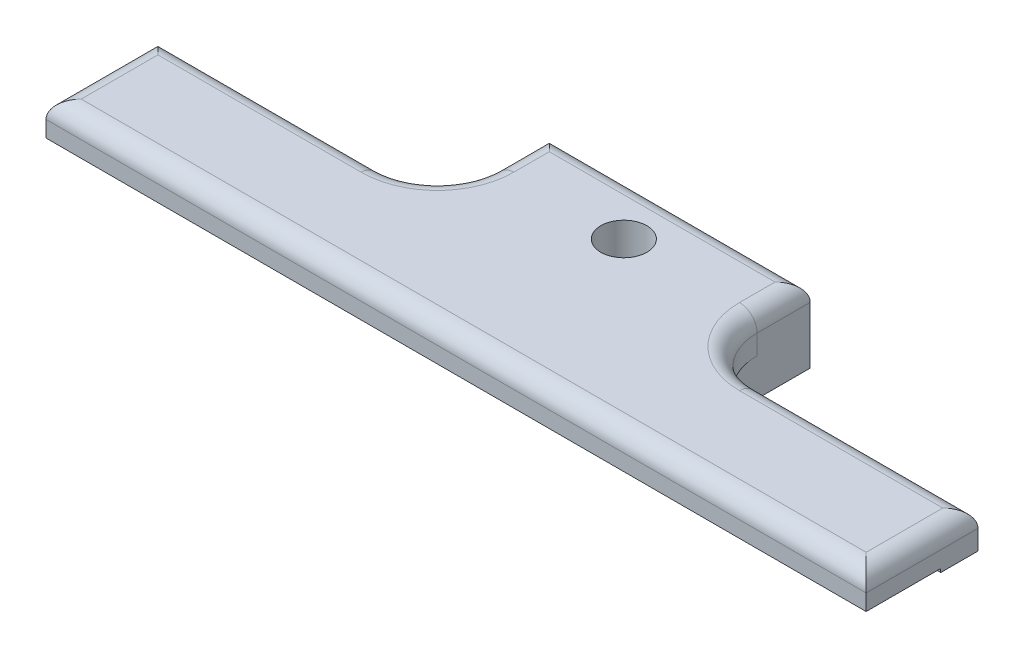
from build123d import *

# Parameters (mm, degrees)
SKETCH1_R           = 8.89
SKETCH1_R_2         = 3.925
BOSS_EXTRUDE1_DEPTH = 6.35
SKETCH2_W           = 12.7
SKETCH2_H           = 0.6
CUT_EXTRUDE1_DEPTH  = 143.733819135
SKETCH3_W           = 3.0988
SKETCH3_H           = 19.05
BOSS_EXTRUDE2_DEPTH = 6.35
FILLET4_R           = 10
FILLET1_R           = 3
FILLET2_R           = 1


with BuildPart() as part:
    # Sketch1 → Boss-Extrude1 (new body)
    # profile 1 of 2: a face of its own
    with BuildSketch(Plane(origin=(0, 0, 0), x_dir=(1, 0, 0), z_dir=(0, 1, 0))):
        Polygon((-69.85, -28.575), (69.85, -28.575), (69.85, -9.525), (22.225, -9.525), (22.225, 9.525), (-22.225, 9.525), (-22.225, -9.525), (-69.85, -9.525), align=None)
        Circle(SKETCH1_R, mode=Mode.SUBTRACT)
    # profile 2 of 2: a face of its own
    with BuildSketch(Plane(origin=(0, 0, 0), x_dir=(1, 0, 0), z_dir=(0, 1, 0))):
        Circle(SKETCH1_R)
        with Locations(Location((0, 0, 0), (0, 0, 270))):
            Circle(SKETCH1_R_2, mode=Mode.SUBTRACT)
    extrude(amount=BOSS_EXTRUDE1_DEPTH)

    # Sketch2 → Cut-Extrude1 (cut, through all)
    with BuildSketch(Plane(origin=(69.85, 0, 0), x_dir=(0, 0, -1), z_dir=(1, 0, 0))):
        with Locations((-22.225, 0.3)):
            Rectangle(SKETCH2_W, SKETCH2_H)
    extrude(amount=-CUT_EXTRUDE1_DEPTH, mode=Mode.SUBTRACT)

    # Sketch3 → Boss-Extrude2 (add)
    with BuildSketch(Plane.XZ):
        with Locations((-20.6756, 0)):
            Rectangle(SKETCH3_W, SKETCH3_H)
    boss_extrude2 = extrude(amount=BOSS_EXTRUDE2_DEPTH)

    # Mirror1: Boss-Extrude2 across plane
    add(boss_extrude2.mirror(Plane(origin=(0, 0, 0), x_dir=(0, 0, 1), z_dir=(1, 0, 0))))

    # Fillet4
    fillet4_edges = [part.edges().sort_by_distance(p)[0] for p in [
        (-22.225, 3.175, 9.525),
        (22.225, 3.175, 9.525),
    ]]
    fillet(fillet4_edges, radius=FILLET4_R)

    # Fillet1
    fillet1_edges = [part.edges().sort_by_distance(p)[0] for p in [
        (0, 6.35, 28.575),
        (69.85, 6.35, 19.05),
        (0, 6.35, -9.525),
        (-51.0375, 6.35, 9.525),
        (-69.85, 6.35, 19.05),
        (22.225, 6.35, -5),
        (51.0375, 6.35, 9.525),
        (-22.225, 6.35, -5),
        (25.153932188, 6.35, 6.596067812),
        (-25.153932188, 6.35, 6.596067812),
    ]]
    fillet(fillet1_edges, radius=FILLET1_R)

    # Fillet2
    fillet2_edges = [part.edges().sort_by_distance(p)[0] for p in [
        (-19.1262, 0, 0),
        (19.1262, 0, 0),
    ]]
    fillet(fillet2_edges, radius=FILLET2_R)


solid = part.part
